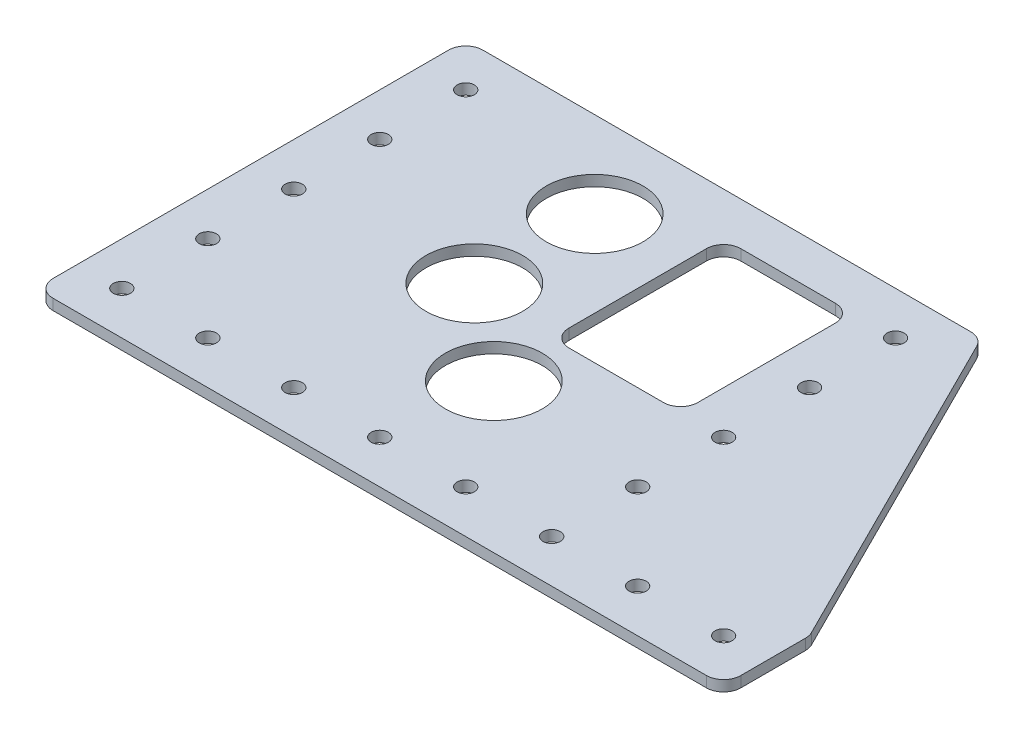
from build123d import *

# Parameters (mm, degrees)
SKETCH1_R           = 2.54
SKETCH1_R_2         = 14.3002
BOSS_EXTRUDE1_DEPTH = 3.175


with BuildPart() as part:
    # Sketch1 → Boss-Extrude1 (new body)
    with BuildSketch(Plane(origin=(0, 0, 0), x_dir=(1, 0, 0), z_dir=(0, 1, 0))):
        with BuildLine():
            Line((0, 5.08), (0, 121.92))
            ThreePointArc((0, 121.92), (1.487897552, 125.512102448), (5.08, 127))
            Line((5.08, 127), (149.260387337, 127))
            ThreePointArc((149.260387337, 127), (151.931101387, 126.241306106), (153.804077467, 124.191845065))
            Line((153.804077467, 124.191845065), (202.66369013, 26.472619739))
            ThreePointArc((202.66369013, 26.472619739), (203.064104866, 25.367919511), (203.2, 24.200774674))
            Line((203.2, 24.200774674), (203.2, 5.08))
            ThreePointArc((203.2, 5.08), (201.712102448, 1.487897552), (198.12, 0))
            Line((198.12, 0), (5.08, 0))
            ThreePointArc((5.08, 0), (1.487897552, 1.487897552), (0, 5.08))
        make_face()
        with Locations(Location((190.5, 12.7, 0), (0, 0, 270))):
            Circle(SKETCH1_R, mode=Mode.SUBTRACT)
        with Locations(Location((165.1, 12.7, 0), (0, 0, 270))):
            Circle(SKETCH1_R, mode=Mode.SUBTRACT)
        with Locations(Location((139.7, 12.7, 0), (0, 0, 270))):
            Circle(SKETCH1_R, mode=Mode.SUBTRACT)
        with Locations(Location((114.3, 12.7, 0), (0, 0, 270))):
            Circle(SKETCH1_R, mode=Mode.SUBTRACT)
        with Locations(Location((88.9, 12.7, 0), (0, 0, 270))):
            Circle(SKETCH1_R, mode=Mode.SUBTRACT)
        with Locations(Location((63.5, 12.7, 0), (0, 0, 270))):
            Circle(SKETCH1_R, mode=Mode.SUBTRACT)
        with Locations(Location((38.1, 12.7, 0), (0, 0, 270))):
            Circle(SKETCH1_R, mode=Mode.SUBTRACT)
        with Locations(Location((12.7, 12.7, 0), (0, 0, 270))):
            Circle(SKETCH1_R, mode=Mode.SUBTRACT)
        with Locations(Location((12.7, 38.1, 0), (0, 0, 270))):
            Circle(SKETCH1_R, mode=Mode.SUBTRACT)
        with Locations(Location((139.7, 38.1, 0), (0, 0, 270))):
            Circle(SKETCH1_R, mode=Mode.SUBTRACT)
        with Locations(Location((12.7, 63.5, 0), (0, 0, 270))):
            Circle(SKETCH1_R, mode=Mode.SUBTRACT)
        with Locations(Location((139.7, 63.5, 0), (0, 0, 270))):
            Circle(SKETCH1_R, mode=Mode.SUBTRACT)
        with Locations(Location((12.7, 88.9, 0), (0, 0, 270))):
            Circle(SKETCH1_R, mode=Mode.SUBTRACT)
        with Locations(Location((139.7, 88.9, 0), (0, 0, 270))):
            Circle(SKETCH1_R, mode=Mode.SUBTRACT)
        with Locations(Location((12.7, 114.3, 0), (0, 0, 270))):
            Circle(SKETCH1_R, mode=Mode.SUBTRACT)
        with Locations(Location((139.7, 114.3, 0), (0, 0, 270))):
            Circle(SKETCH1_R, mode=Mode.SUBTRACT)
        with Locations(Location((63.5, 101.6, 0), (0, 0, 270))):
            Circle(SKETCH1_R_2, mode=Mode.SUBTRACT)
        with Locations(Location((63.5, 66.04, 0), (0, 0, 270))):
            Circle(SKETCH1_R_2, mode=Mode.SUBTRACT)
        with Locations(Location((91.360222469, 43.942, 0), (0, 0, 270))):
            Circle(SKETCH1_R_2, mode=Mode.SUBTRACT)
        with BuildLine():
            Line((93.98, 114.3), (121.92, 114.3))
            ThreePointArc((121.92, 114.3), (125.512102448, 112.812102448), (127, 109.22))
            Line((127, 109.22), (127, 68.58))
            ThreePointArc((127, 68.58), (125.512102448, 64.987897552), (121.92, 63.5))
            Line((121.92, 63.5), (93.98, 63.5))
            ThreePointArc((93.98, 63.5), (90.387897552, 64.987897552), (88.9, 68.58))
            Line((88.9, 68.58), (88.9, 109.22))
            ThreePointArc((88.9, 109.22), (90.387897552, 112.812102448), (93.98, 114.3))
        make_face(mode=Mode.SUBTRACT)
    extrude(amount=BOSS_EXTRUDE1_DEPTH)


solid = part.part
